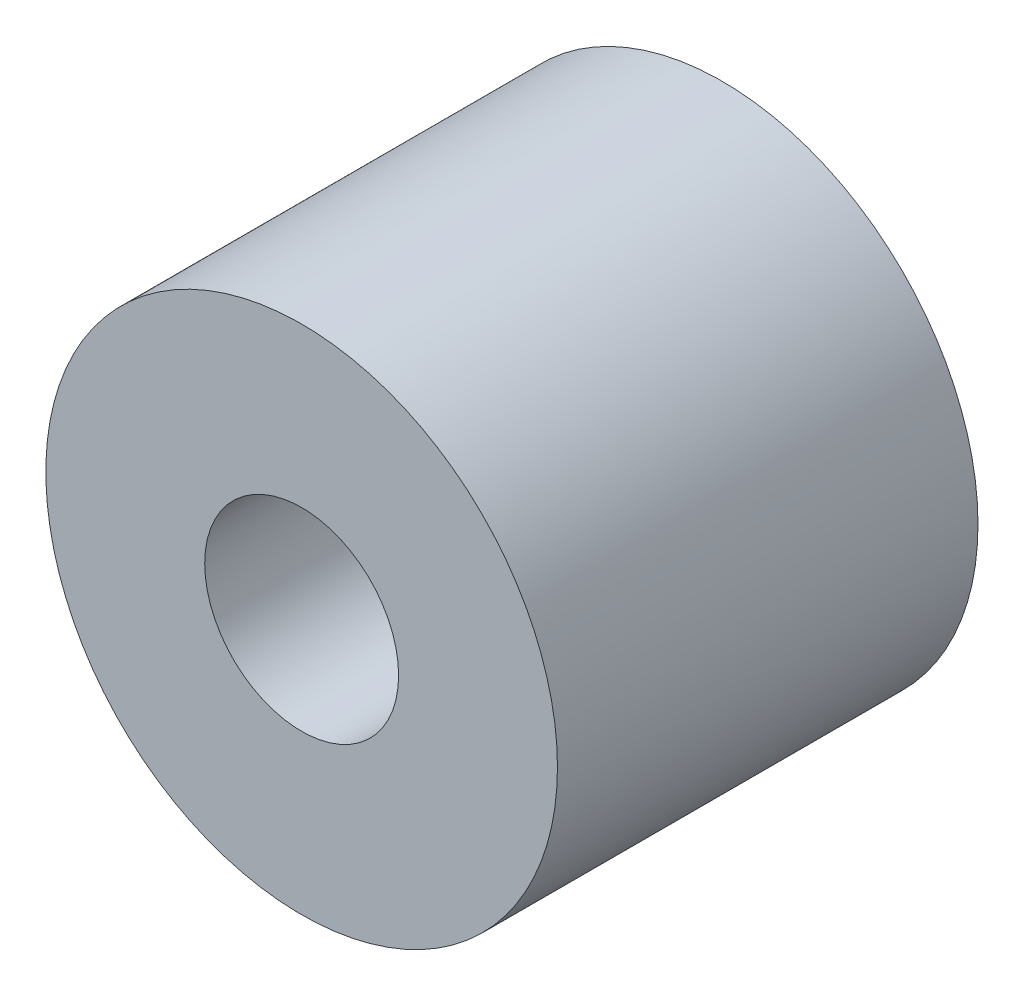
from build123d import *

# Parameters (mm, degrees)
SKETCH1_R           = 10.95
SKETCH1_R_2         = 4.15
BOSS_EXTRUDE1_DEPTH = 18


with BuildPart() as part:
    # Sketch1 → Boss-Extrude1 (new body)
    with BuildSketch(Plane.XY):
        Circle(SKETCH1_R)
        Circle(SKETCH1_R_2, mode=Mode.SUBTRACT)
    extrude(amount=BOSS_EXTRUDE1_DEPTH)


solid = part.part
